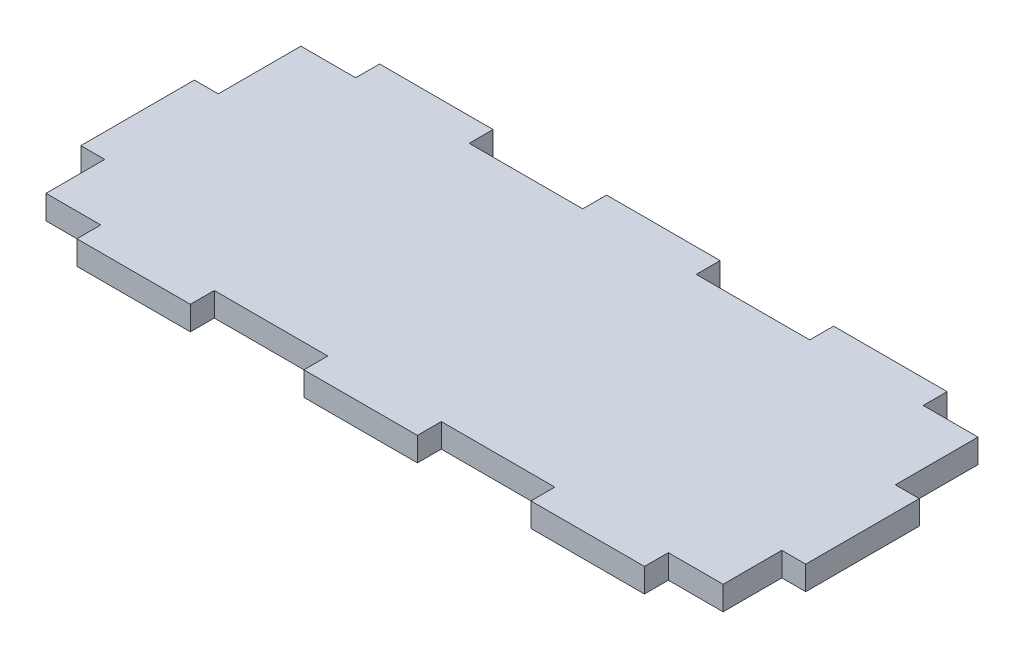
from build123d import *

# Parameters (mm, degrees)
BOSS_EXTRUDE1_DEPTH = 3


with BuildPart() as part:
    # Sketch1 → Boss-Extrude1 (new body)
    with BuildSketch(Plane(origin=(0, 0, 0), x_dir=(1, 0, 0), z_dir=(0, 1, 0))):
        Polygon((-41.556260071, 14.257821204), (-41.556260071, 3.882821204), (-44.556260071, 3.882821204), (-44.556260071, -10.367178796), (-41.556260071, -10.367178796), (-41.556260071, -17.742178796), (-34.681260071, -17.742178796), (-34.681260071, -20.742178796), (-20.431260071, -20.742178796), (-20.431260071, -17.742178796), (-6.181260071, -17.742178796), (-6.181260071, -20.742178796), (8.068739929, -20.742178796), (8.068739929, -17.742178796), (22.318739929, -17.742178796), (22.318739929, -20.742178796), (36.568739929, -20.742178796), (36.568739929, -17.742178796), (43.443739929, -17.742178796), (43.443739929, -10.367178796), (46.443739929, -10.367178796), (46.443739929, 3.882821204), (43.443739929, 3.882821204), (43.443739929, 14.257821204), (36.568739929, 14.257821204), (36.568739929, 17.257821204), (22.318739929, 17.257821204), (22.318739929, 14.257821204), (8.068739929, 14.257821204), (8.068739929, 17.257821204), (-6.181260071, 17.257821204), (-6.181260071, 14.257821204), (-20.431260071, 14.257821204), (-20.431260071, 17.257821204), (-34.681260071, 17.257821204), (-34.681260071, 14.257821204), align=None)
    extrude(amount=BOSS_EXTRUDE1_DEPTH)


solid = part.part
